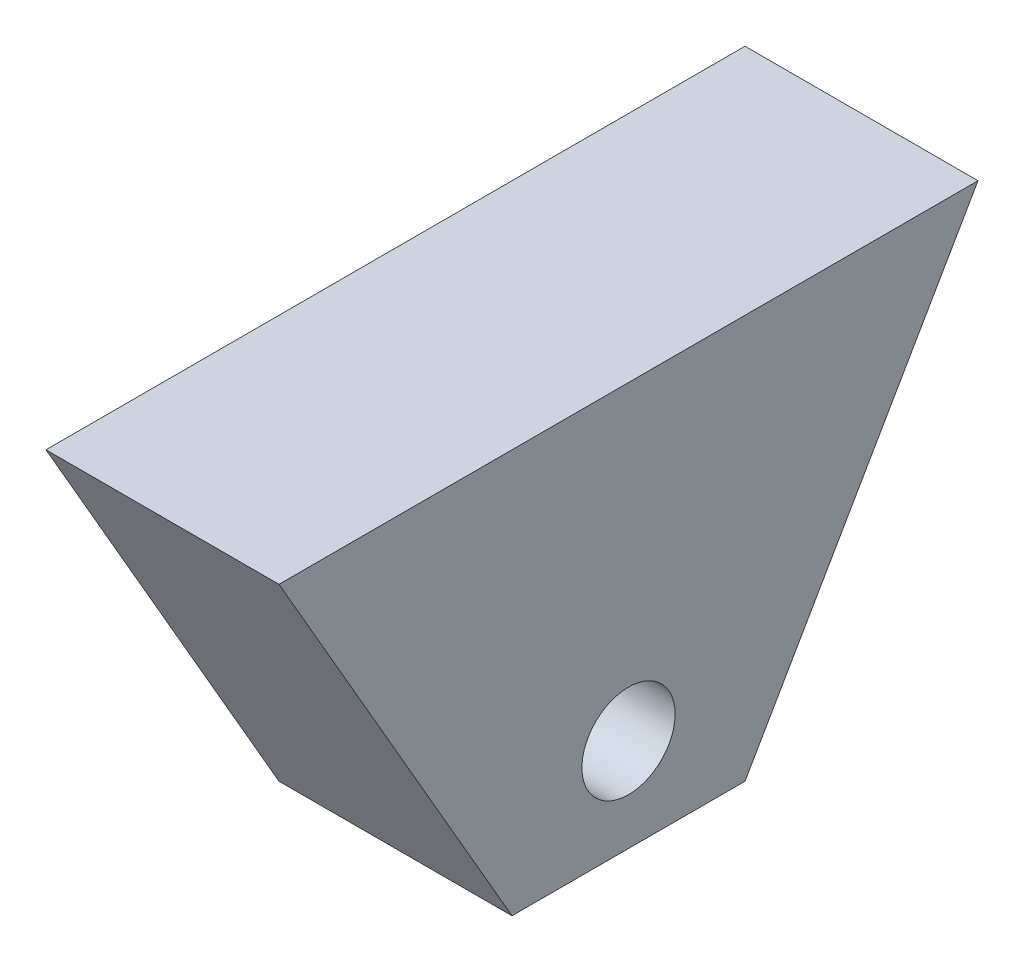
from build123d import *

# Parameters (mm, degrees)
BOSS_EXTRUDE1_DEPTH = 50
SKETCH2_R           = 10
CUT_EXTRUDE1_DEPTH  = 181.277563773


with BuildPart() as part:
    # Sketch1 → Boss-Extrude1 (new body)
    with BuildSketch(Plane(origin=(0, 0, 0), x_dir=(0, 0, -1), z_dir=(1, 0, 0))):
        Polygon((0, 0), (150, 0), (100, -86.602540378), (50, -86.602540378), align=None)
    extrude(amount=BOSS_EXTRUDE1_DEPTH)

    # Sketch2 → Cut-Extrude1 (cut, through all)
    with BuildSketch(Plane(origin=(50, 0, 0), x_dir=(0, 0, -1), z_dir=(1, 0, 0))):
        with Locations((75, -66.602540378)):
            Circle(SKETCH2_R)
    extrude(amount=-CUT_EXTRUDE1_DEPTH, mode=Mode.SUBTRACT)


solid = part.part
